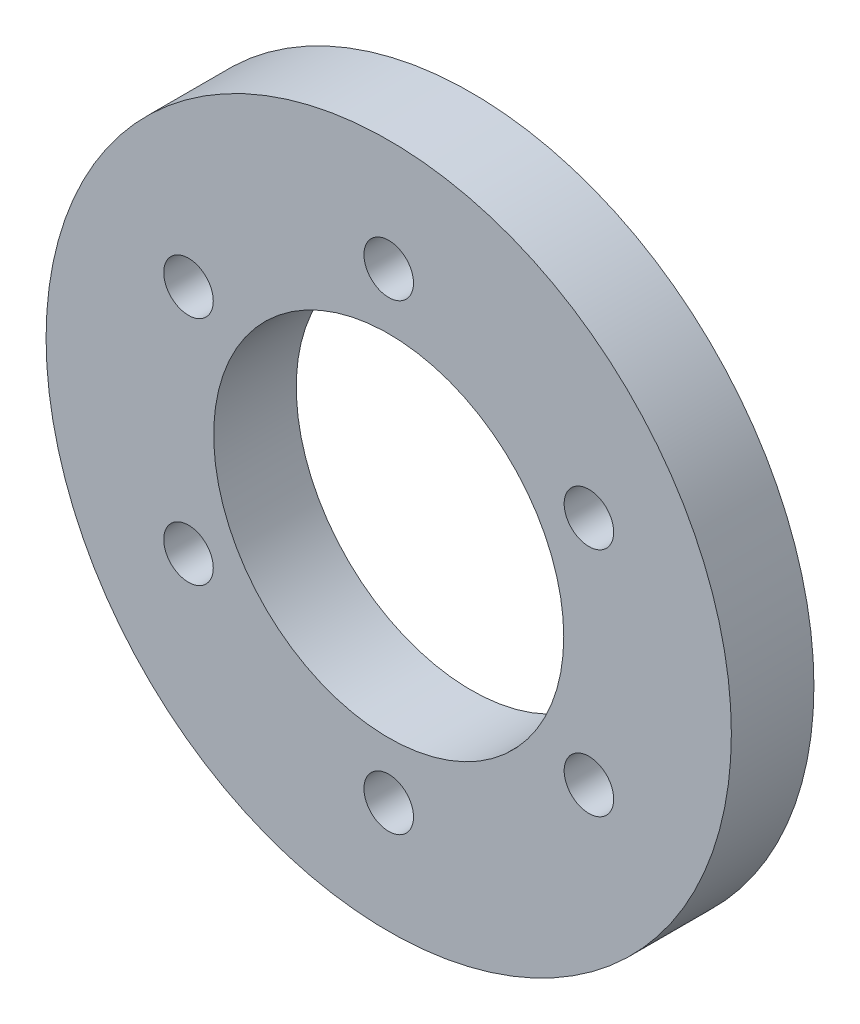
from build123d import *

# Parameters (mm, degrees)
SKETCH_1_R      = 20.75
EXTRUDE_1_DEPTH = 5


with BuildPart() as part:
    # 草图1 → 凸台-拉伸1 (new body)
    with BuildSketch(Plane.XY):
        Circle(SKETCH_1_R)
        with BuildLine():
            ThreePointArc((-12.124355653, 5.5), (-10.624355653, 7), (-12.124355653, 8.5))
            ThreePointArc((-12.124355653, 8.5), (-13.624355653, 7), (-12.124355653, 5.5))
        make_face(mode=Mode.SUBTRACT)
        with BuildLine():
            ThreePointArc((-12.124355653, -8.5), (-10.624355653, -7), (-12.124355653, -5.5))
            ThreePointArc((-12.124355653, -5.5), (-13.624355653, -7), (-12.124355653, -8.5))
        make_face(mode=Mode.SUBTRACT)
        with BuildLine():
            ThreePointArc((0, -15.5), (1.5, -14), (0, -12.5))
            ThreePointArc((0, -12.5), (-1.5, -14), (0, -15.5))
        make_face(mode=Mode.SUBTRACT)
        with BuildLine():
            ThreePointArc((12.124355653, -8.5), (13.624355653, -7), (12.124355653, -5.5))
            ThreePointArc((12.124355653, -5.5), (10.624355653, -7), (12.124355653, -8.5))
        make_face(mode=Mode.SUBTRACT)
        with BuildLine():
            ThreePointArc((12.124355653, 5.5), (13.624355653, 7), (12.124355653, 8.5))
            ThreePointArc((12.124355653, 8.5), (10.624355653, 7), (12.124355653, 5.5))
        make_face(mode=Mode.SUBTRACT)
        with BuildLine():
            ThreePointArc((0, 12.5), (1.5, 14), (0, 15.5))
            ThreePointArc((0, 15.5), (-1.5, 14), (0, 12.5))
        make_face(mode=Mode.SUBTRACT)
        with BuildLine():
            ThreePointArc((10.6, 0), (7.495331881, 7.495331881), (0, 10.6))
            ThreePointArc((0, 10.6), (-7.495331881, 7.495331881), (-10.6, 0))
            ThreePointArc((-10.6, 0), (0, -10.6), (10.6, 0))
        make_face(mode=Mode.SUBTRACT)
    extrude(amount=EXTRUDE_1_DEPTH)


solid = part.part
